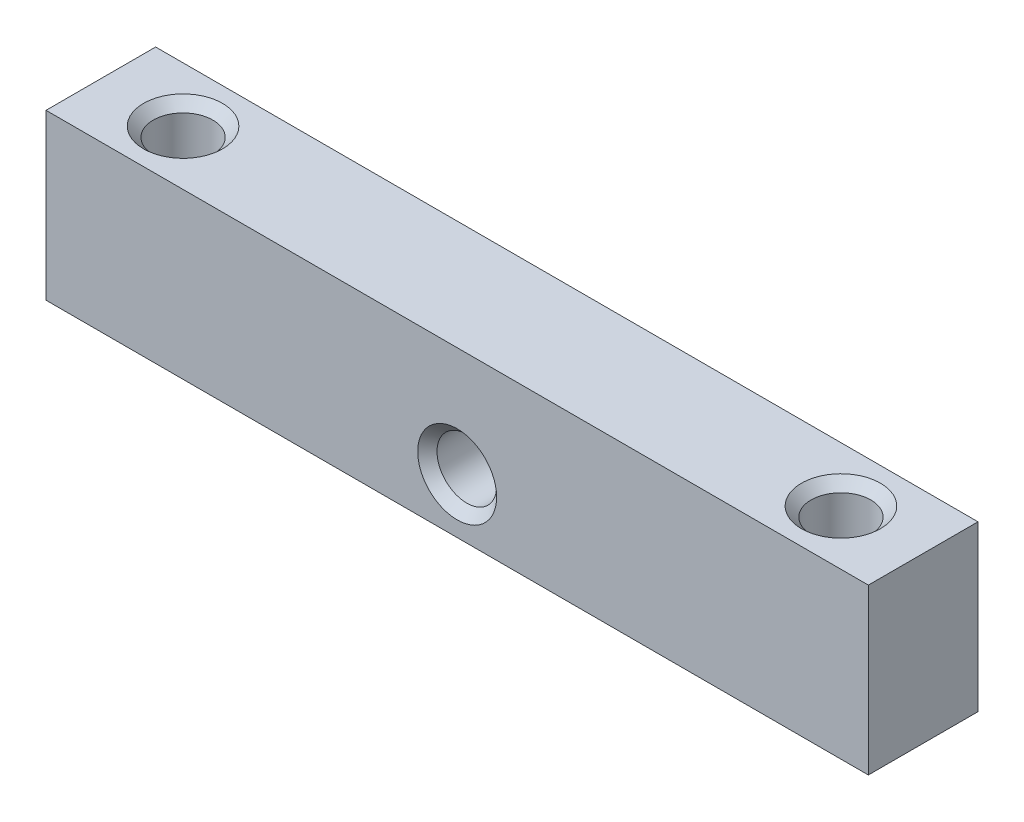
from build123d import *

# Parameters (mm, degrees)
SKETCH1_W                      = 6.35
SKETCH1_H                      = 9.525
BOSS_EXTRUDE1_DEPTH            = 23.8125
F_8_32_TAPPED_HOLE1_AT_2_COUNT = 2
F_8_32_TAPPED_HOLE1_AT_2_PITCH = 38.1


with BuildPart() as part:
    # Sketch1 → Boss-Extrude1 (new, symmetric)
    with BuildSketch(Plane(origin=(0, 0, 0), x_dir=(0, 0, -1), z_dir=(1, 0, 0))):
        Rectangle(SKETCH1_W, SKETCH1_H)
    extrude(amount=BOSS_EXTRUDE1_DEPTH, both=True)

    # Sketch2 → #8-32 Tapped Hole1 (revolve, cut)
    with BuildSketch(Plane(origin=(19.05, 4.7625, 0), x_dir=(0, 0, 1), z_dir=(1, 0, 0))):
        Polygon((0, 0), (0, 9.525), (2.286, 9.525), (1.7272, 8.9662), (1.7272, 0.5588), (2.286, 0), align=None)
    f_8_32_tapped_hole1 = revolve(axis=Axis((19.05, 11.1125, 0), (0, -1, 0)), mode=Mode.SUBTRACT)

    # #8-32 Tapped Hole1 at 2: #8-32 Tapped Hole1 ×2
    with Locations(*[(-i * F_8_32_TAPPED_HOLE1_AT_2_PITCH, 0, 0) for i in range(1, F_8_32_TAPPED_HOLE1_AT_2_COUNT)]):
        add(f_8_32_tapped_hole1, mode=Mode.SUBTRACT)

    # Sketch4 → #8-32 Tapped Hole2 (revolve, cut)
    with BuildSketch(Plane(origin=(0, -1.5875, 3.175), x_dir=(0, -1, 0), z_dir=(1, 0, 0))):
        Polygon((0, 0), (0, 6.35), (2.286, 6.35), (1.7272, 5.7912), (1.7272, 0.5588), (2.286, 0), align=None)
    revolve(axis=Axis((0, -1.5875, 9.525), (0, 0, -1)), mode=Mode.SUBTRACT)


solid = part.part
